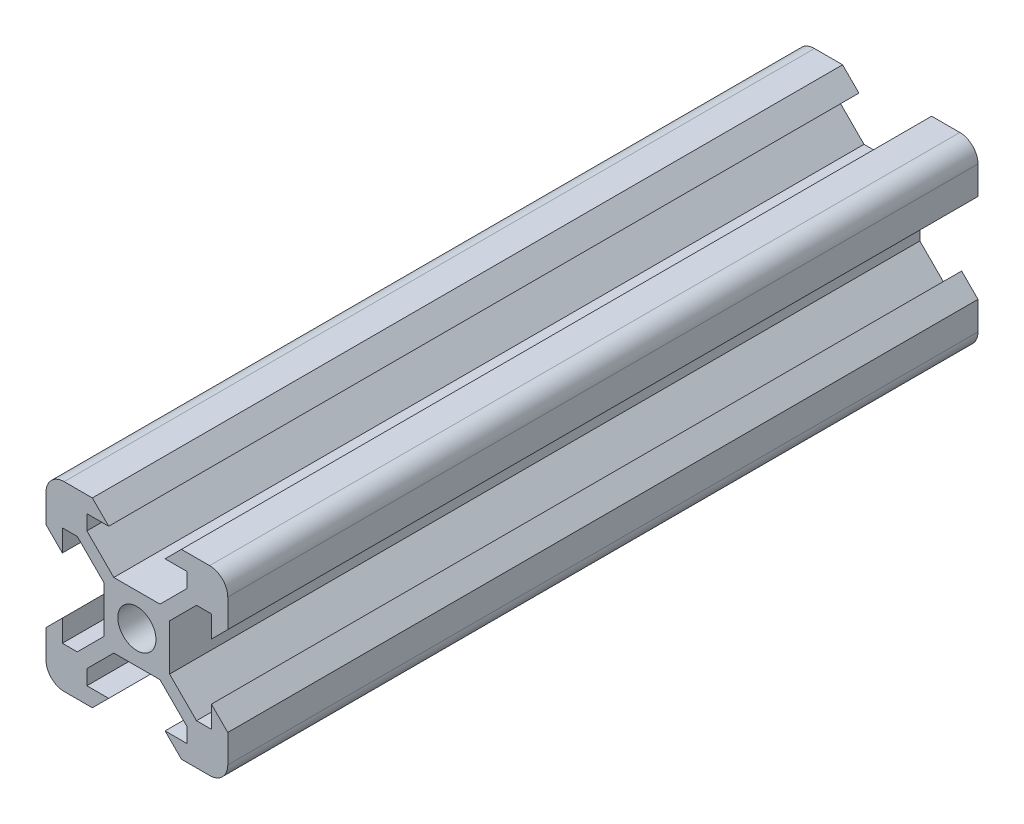
from build123d import *

# Parameters (mm, degrees)
SKETCH1_R           = 2.1
BOSS_EXTRUDE1_DEPTH = 82.55


with BuildPart() as part:
    # Sketch1 → Boss-Extrude1 (new body)
    with BuildSketch(Plane.XY):
        with BuildLine():
            Line((-4.9, -10), (-3.1, -8.2))
            Line((-3.1, -8.2), (-5.5, -8.2))
            Line((-5.5, -8.2), (-5.5, -6.560660172))
            Line((-5.5, -6.560660172), (-2.539339828, -3.6))
            Line((-2.539339828, -3.6), (2.539339828, -3.6))
            Line((2.539339828, -3.6), (5.5, -6.560660172))
            Line((5.5, -6.560660172), (5.5, -8.2))
            Line((5.5, -8.2), (3.1, -8.2))
            Line((3.1, -8.2), (4.9, -10))
            Line((4.9, -10), (8, -10))
            ThreePointArc((8, -10), (9.414213562, -9.414213562), (10, -8))
            Line((10, -8), (10, -4.9))
            Line((10, -4.9), (8.2, -3.1))
            Line((8.2, -3.1), (8.2, -5.5))
            Line((8.2, -5.5), (6.560660172, -5.5))
            Line((6.560660172, -5.5), (3.6, -2.539339828))
            Line((3.6, -2.539339828), (3.6, 2.539339828))
            Line((3.6, 2.539339828), (6.560660172, 5.5))
            Line((6.560660172, 5.5), (8.2, 5.5))
            Line((8.2, 5.5), (8.2, 3.1))
            Line((8.2, 3.1), (10, 4.9))
            Line((10, 4.9), (10, 8))
            ThreePointArc((10, 8), (9.414213562, 9.414213562), (8, 10))
            Line((8, 10), (4.9, 10))
            Line((4.9, 10), (3.1, 8.2))
            Line((3.1, 8.2), (5.5, 8.2))
            Line((5.5, 8.2), (5.5, 6.560660172))
            Line((5.5, 6.560660172), (2.539339828, 3.6))
            Line((2.539339828, 3.6), (-2.539339828, 3.6))
            Line((-2.539339828, 3.6), (-5.5, 6.560660172))
            Line((-5.5, 6.560660172), (-5.5, 8.2))
            Line((-5.5, 8.2), (-3.1, 8.2))
            Line((-3.1, 8.2), (-4.9, 10))
            Line((-4.9, 10), (-8, 10))
            ThreePointArc((-8, 10), (-9.414213562, 9.414213562), (-10, 8))
            Line((-10, 8), (-10, 4.9))
            Line((-10, 4.9), (-8.2, 3.1))
            Line((-8.2, 3.1), (-8.2, 5.5))
            Line((-8.2, 5.5), (-6.560660172, 5.5))
            Line((-6.560660172, 5.5), (-3.6, 2.539339828))
            Line((-3.6, 2.539339828), (-3.6, -2.539339828))
            Line((-3.6, -2.539339828), (-6.560660172, -5.5))
            Line((-6.560660172, -5.5), (-8.2, -5.5))
            Line((-8.2, -5.5), (-8.2, -3.1))
            Line((-8.2, -3.1), (-10, -4.9))
            Line((-10, -4.9), (-10, -8))
            ThreePointArc((-10, -8), (-9.414213562, -9.414213562), (-8, -10))
            Line((-8, -10), (-4.9, -10))
        make_face()
        Circle(SKETCH1_R, mode=Mode.SUBTRACT)
    extrude(amount=BOSS_EXTRUDE1_DEPTH)


solid = part.part
